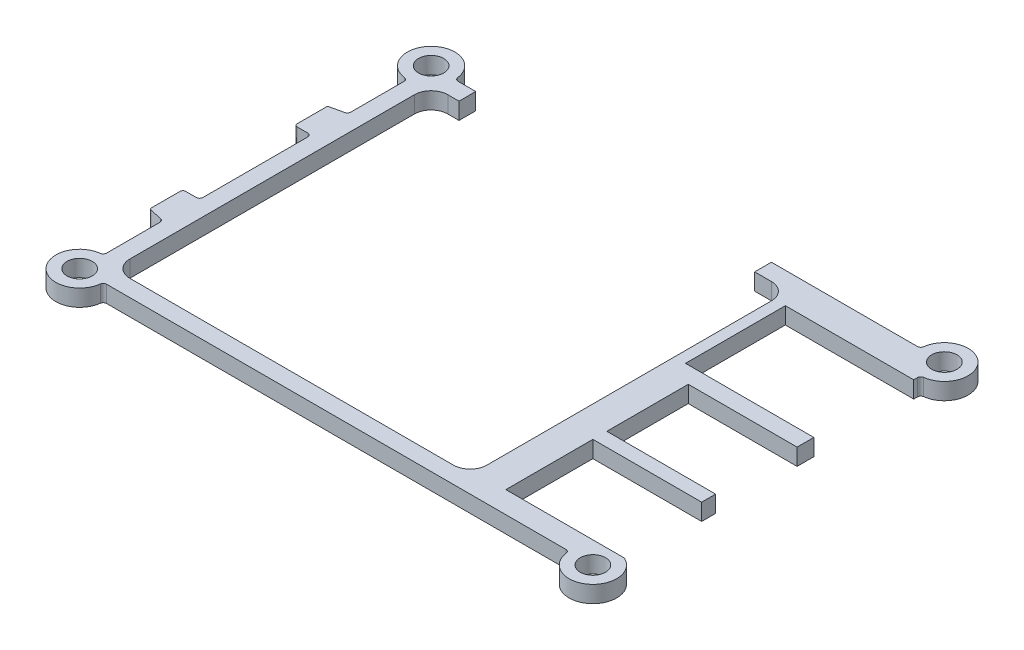
from build123d import *

# Parameters (mm, degrees)
SKETCH1_R           = 2.265
BOSS_EXTRUDE1_DEPTH = 3
SKETCH2_W           = 6.5
SKETCH2_H           = 20
CUT_EXTRUDE1_DEPTH  = 3
BOSS_EXTRUDE2_DEPTH = 3
CUT_EXTRUDE2_DEPTH  = 3
SKETCH5_W           = 3
SKETCH5_H           = 20
BOSS_EXTRUDE3_DEPTH = 3
SKETCH6_W           = 27.010134686
SKETCH6_H           = 17.9
CUT_EXTRUDE3_DEPTH  = 3
SKETCH7_W           = 19.5
SKETCH7_H           = 14.6
CUT_EXTRUDE4_DEPTH  = 3
SKETCH8_W           = 19.5
SKETCH8_H           = 15.6
CUT_EXTRUDE5_DEPTH  = 3
SKETCH9_W           = 2.019620965
SKETCH9_H           = 0.574286347
CUT_EXTRUDE6_DEPTH  = 3
FILLET1_R           = 0.6
SKETCH10_W          = 53
SKETCH10_H          = 3
CUT_EXTRUDE7_DEPTH  = 10


with BuildPart() as part:
    # Sketch1 → Boss-Extrude1 (new body)
    with BuildSketch(Plane(origin=(0, 0, 0), x_dir=(1, 0, 0), z_dir=(0, 1, 0))):
        with BuildLine():
            Line((4.265, 0), (87.735, 0))
            ThreePointArc((87.735, 0), (95.015810422, 3.015810422), (92, -4.265))
            Line((92, -4.265), (92, -58.735))
            ThreePointArc((92, -58.735), (95.015810422, -66.015810422), (87.735, -63))
            Line((87.735, -63), (4.265, -63))
            ThreePointArc((4.265, -63), (-3.015810422, -66.015810422), (0, -58.735))
            Line((0, -58.735), (0, -4.265))
            ThreePointArc((0, -4.265), (-3.015810422, 3.015810422), (4.265, 0))
        make_face()
        with Locations(Location((0, 0, 0), (0, 0, 270))):
            Circle(SKETCH1_R, mode=Mode.SUBTRACT)
        with Locations(Location((92, 0, 0), (0, 0, 270))):
            Circle(SKETCH1_R, mode=Mode.SUBTRACT)
        with Locations(Location((92, -63, 0), (0, 0, 270))):
            Circle(SKETCH1_R, mode=Mode.SUBTRACT)
        with Locations(Location((0, -63, 0), (0, 0, 270))):
            Circle(SKETCH1_R, mode=Mode.SUBTRACT)
    extrude(amount=BOSS_EXTRUDE1_DEPTH)

    # Sketch2 → Cut-Extrude1 (cut)
    with BuildSketch(Plane(origin=(0, 3, 0), x_dir=(1, 0, 0), z_dir=(0, 1, 0))):
        with Locations((3.25, -31.5)):
            Rectangle(SKETCH2_W, SKETCH2_H)
    extrude(amount=-CUT_EXTRUDE1_DEPTH, mode=Mode.SUBTRACT)

    # Sketch3 → Boss-Extrude2 (add)
    with BuildSketch(Plane(origin=(0, 3, 0), x_dir=(1, 0, 0), z_dir=(0, 1, 0))):
        with BuildLine():
            Line((-2.7, -15.5), (0, -14.9))
            Line((0, -14.9), (0, -21.5))
            Line((0, -21.5), (-2.5, -21.5))
            ThreePointArc((-2.5, -21.5), (-2.853553391, -21.353553391), (-3, -21))
            Line((-3, -21), (-3, -15.8))
            ThreePointArc((-3, -15.8), (-2.912132034, -15.587867966), (-2.7, -15.5))
        make_face()
        with BuildLine():
            Line((-3, -42), (-3, -47.2))
            ThreePointArc((-3, -47.2), (-2.912132034, -47.412132034), (-2.7, -47.5))
            Line((-2.7, -47.5), (0, -48.1))
            Line((0, -48.1), (0, -41.5))
            Line((0, -41.5), (-2.5, -41.5))
            ThreePointArc((-2.5, -41.5), (-2.853553391, -41.646446609), (-3, -42))
        make_face()
    extrude(amount=-BOSS_EXTRUDE2_DEPTH)

    # Sketch4 → Cut-Extrude2 (cut)
    with BuildSketch(Plane(origin=(0, 3, 0), x_dir=(1, 0, 0), z_dir=(0, 1, 0))):
        with BuildLine():
            Line((6, -3), (64, -3))
            ThreePointArc((64, -3), (66.121320344, -3.878679656), (67, -6))
            Line((67, -6), (67, -57))
            ThreePointArc((67, -57), (66.121320344, -59.121320344), (64, -60))
            Line((64, -60), (6, -60))
            ThreePointArc((6, -60), (3.878679656, -59.121320344), (3, -57))
            Line((3, -57), (3, -6))
            ThreePointArc((3, -6), (3.878679656, -3.878679656), (6, -3))
        make_face()
    extrude(amount=-CUT_EXTRUDE2_DEPTH, mode=Mode.SUBTRACT)

    # Sketch5 → Boss-Extrude3 (add)
    with BuildSketch(Plane(origin=(0, 3, 0), x_dir=(1, 0, 0), z_dir=(0, 1, 0))):
        with Locations((1.5, -31.5)):
            Rectangle(SKETCH5_W, SKETCH5_H)
    extrude(amount=-BOSS_EXTRUDE3_DEPTH)

    # Sketch6 → Cut-Extrude3 (cut)
    with BuildSketch(Plane(origin=(0, 3, 0), x_dir=(1, 0, 0), z_dir=(0, 1, 0))):
        with Locations((82.505067343, -14.45)):
            Rectangle(SKETCH6_W, SKETCH6_H)
    extrude(amount=-CUT_EXTRUDE3_DEPTH, mode=Mode.SUBTRACT)

    # Sketch7 → Cut-Extrude4 (cut)
    with BuildSketch(Plane(origin=(0, 3, 0), x_dir=(1, 0, 0), z_dir=(0, 1, 0))):
        with Locations((82.25, -33.7)):
            Rectangle(SKETCH7_W, SKETCH7_H)
    extrude(amount=-CUT_EXTRUDE4_DEPTH, mode=Mode.SUBTRACT)

    # Sketch8 → Cut-Extrude5 (cut)
    with BuildSketch(Plane(origin=(0, 3, 0), x_dir=(1, 0, 0), z_dir=(0, 1, 0))):
        with Locations((82.25, -51.3)):
            Rectangle(SKETCH8_W, SKETCH8_H)
    extrude(amount=-CUT_EXTRUDE5_DEPTH, mode=Mode.SUBTRACT)

    # Sketch9 → Cut-Extrude6 (cut)
    with BuildSketch(Plane(origin=(0, 3, 0), x_dir=(1, 0, 0), z_dir=(0, 1, 0))):
        with Locations((93.009810483, -58.812856827)):
            Rectangle(SKETCH9_W, SKETCH9_H)
    extrude(amount=-CUT_EXTRUDE6_DEPTH, mode=Mode.SUBTRACT)

    # Fillet1
    fillet1_edges = [part.edges().sort_by_distance(p)[0] for p in [
        (0, 1.5, 41.5),
        (92, 1.5, 4.265),
        (0, 1.5, 21.5),
        (87.735, 1.5, 63),
        (4.265, 1.5, 63),
        (0, 1.5, 58.735),
        (0, 1.5, 4.265),
        (4.265, 1.5, 0),
        (87.735, 1.5, 0),
        (93.726332818, 1.5, 59.1),
        (0, 1.5, 14.9),
        (0, 1.5, 48.1),
    ]]
    fillet(fillet1_edges, radius=FILLET1_R)

    # Sketch10 → Cut-Extrude7 (cut)
    with BuildSketch(Plane(origin=(0, 3, 0), x_dir=(1, 0, 0), z_dir=(0, 1, 0))):
        with Locations((34.5, -1.5)):
            Rectangle(SKETCH10_W, SKETCH10_H)
    extrude(amount=-CUT_EXTRUDE7_DEPTH, mode=Mode.SUBTRACT)


solid = part.part
